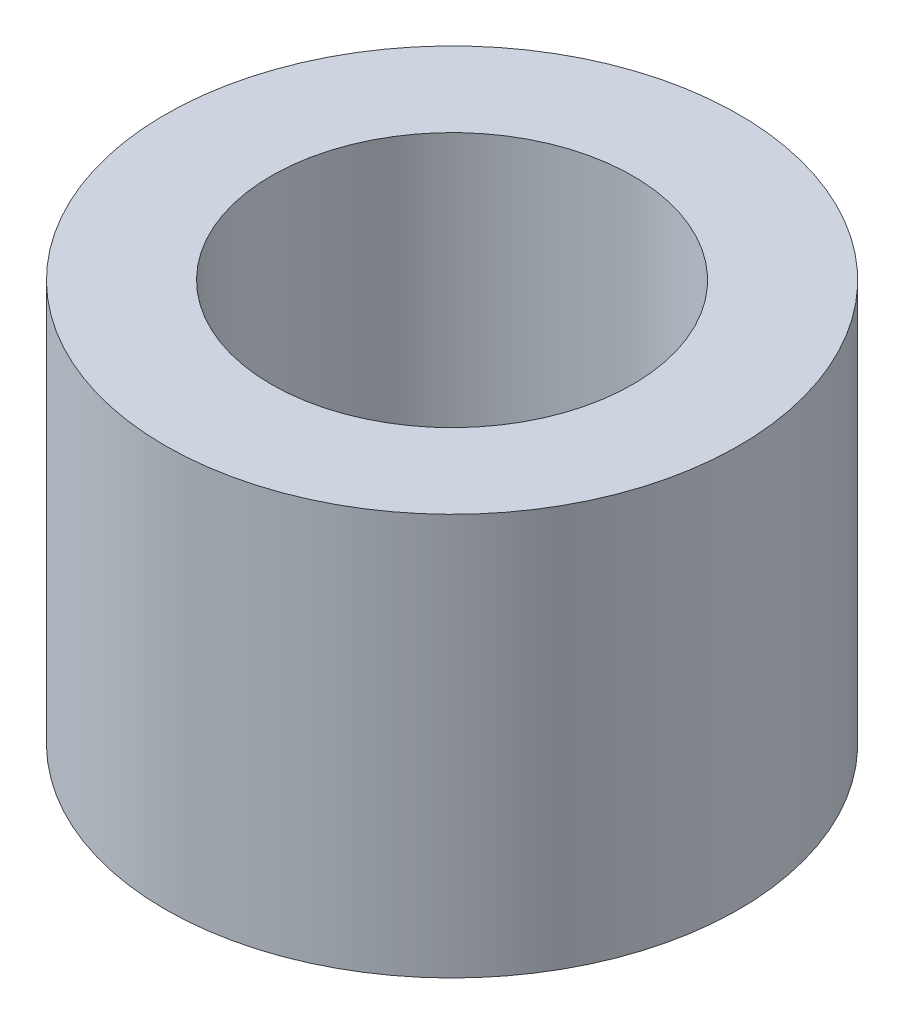
from build123d import *

# Parameters (mm, degrees)
SKETCH_1_R      = 5
SKETCH_1_R_2    = 3.15
EXTRUDE_1_DEPTH = 7


with BuildPart() as part:
    # 草图1 → 凸台-拉伸1 (new body)
    with BuildSketch(Plane(origin=(0, 0, 0), x_dir=(1, 0, 0), z_dir=(0, 1, 0))):
        with Locations(Location((0, 0, 0), (0, 0, 270))):
            Circle(SKETCH_1_R)
        with Locations(Location((0, 0, 0), (0, 0, 270))):
            Circle(SKETCH_1_R_2, mode=Mode.SUBTRACT)
    extrude(amount=EXTRUDE_1_DEPTH)


solid = part.part
